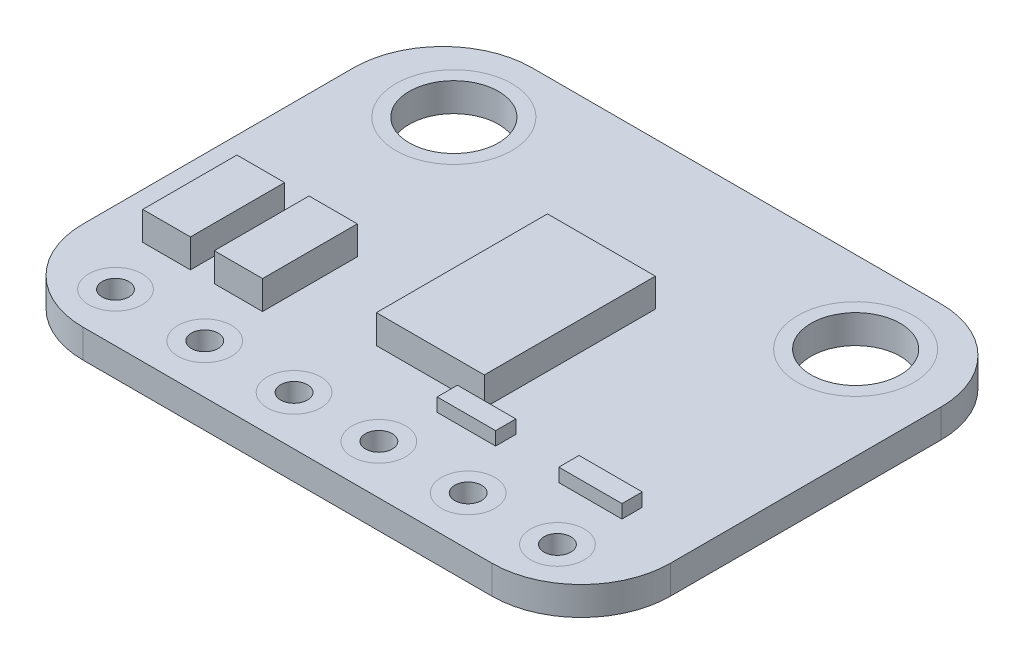
from build123d import *

# Parameters (mm, degrees)
BOSS_EXTRUDE1_DEPTH = 0.8128
SKETCH2_R           = 0.381
SKETCH2_R_2         = 1.27
CUT_EXTRUDE1_DEPTH  = 0.8128
SKETCH4_W           = 3.069128824
SKETCH4_H           = 4.866519185
SKETCH4_W_2         = 1.37347754
SKETCH4_H_2         = 2.696085542
SKETCH4_W_3         = 1.356521027
SKETCH4_H_3         = 2.679129029
BOSS_EXTRUDE2_DEPTH = 0.8128
SKETCH4_3_W         = 1.661738258
SKETCH4_3_H         = 0.576521436
SKETCH4_3_W_2       = 1.797390361
BOSS_EXTRUDE3_DEPTH = 0.381


with BuildPart() as part:
    # Sketch1 → Boss-Extrude1 (new body)
    with BuildSketch(Plane(origin=(0, 0, 0), x_dir=(1, 0, 0), z_dir=(0, 1, 0))):
        with BuildLine():
            Line((5.8166, 6.3881), (-5.8166, 6.3881))
            ThreePointArc((-5.8166, 6.3881), (-7.612651224, 5.644151224), (-8.3566, 3.8481))
            Line((-8.3566, 3.8481), (-8.3566, -3.8481))
            ThreePointArc((-8.3566, -3.8481), (-7.612651224, -5.644151224), (-5.8166, -6.3881))
            Line((-5.8166, -6.3881), (5.8166, -6.3881))
            ThreePointArc((5.8166, -6.3881), (7.612651224, -5.644151224), (8.3566, -3.8481))
            Line((8.3566, -3.8481), (8.3566, 3.8481))
            ThreePointArc((8.3566, 3.8481), (7.612651224, 5.644151224), (5.8166, 6.3881))
        make_face()
    extrude(amount=BOSS_EXTRUDE1_DEPTH)

    # Sketch2 → Cut-Extrude1 (cut)
    with BuildSketch(Plane(origin=(0, 0.8128, 0), x_dir=(1, 0, 0), z_dir=(0, 1, 0))):
        with Locations(Location((-1.2065, -4.993693032, 0), (0, 0, 270))):
            Circle(SKETCH2_R)
        with Locations(Location((-5.715, 4.061084825, 0), (0, 0, 270))):
            Circle(SKETCH2_R_2)
        with Locations(Location((-3.7465, -4.993693032, 0), (0, 0, 270))):
            Circle(SKETCH2_R)
        with Locations(Location((-6.2865, -4.993693032, 0), (0, 0, 270))):
            Circle(SKETCH2_R)
        with Locations(Location((6.2865, -4.993693032, 0), (0, 0, 90))):
            Circle(SKETCH2_R)
        with Locations(Location((3.7465, -4.993693032, 0), (0, 0, 90))):
            Circle(SKETCH2_R)
        with Locations(Location((5.715, 4.061084825, 0), (0, 0, 90))):
            Circle(SKETCH2_R_2)
        with Locations(Location((1.2065, -4.993693032, 0), (0, 0, 90))):
            Circle(SKETCH2_R)
    extrude(amount=-CUT_EXTRUDE1_DEPTH, mode=Mode.SUBTRACT)

    # Sketch4 → Boss-Extrude2 (add)
    with BuildSketch(Plane(origin=(0, 0.8128, 0), x_dir=(1, 0, 0), z_dir=(0, 1, 0))):
        with Locations((0.347608513, -0.237391179)):
            Rectangle(SKETCH4_W, SKETCH4_H)
        with Locations((-4.332389031, -2.102607592)):
            Rectangle(SKETCH4_W_2, SKETCH4_H_2)
        with Locations((-6.375648829, -2.111085849)):
            Rectangle(SKETCH4_W_3, SKETCH4_H_3)
    extrude(amount=BOSS_EXTRUDE2_DEPTH)

    # Sketch4<3> → Boss-Extrude3 (add)
    with BuildSketch(Plane(origin=(0, 0.8128, 0), x_dir=(1, 0, 0), z_dir=(0, 1, 0))):
        with Locations((2.153477131, -3.162389645)):
            Rectangle(SKETCH4_3_W, SKETCH4_3_H)
        with Locations((5.680431802, -3.162389645)):
            Rectangle(SKETCH4_3_W_2, SKETCH4_3_H)
    extrude(amount=BOSS_EXTRUDE3_DEPTH)


solid = part.part
